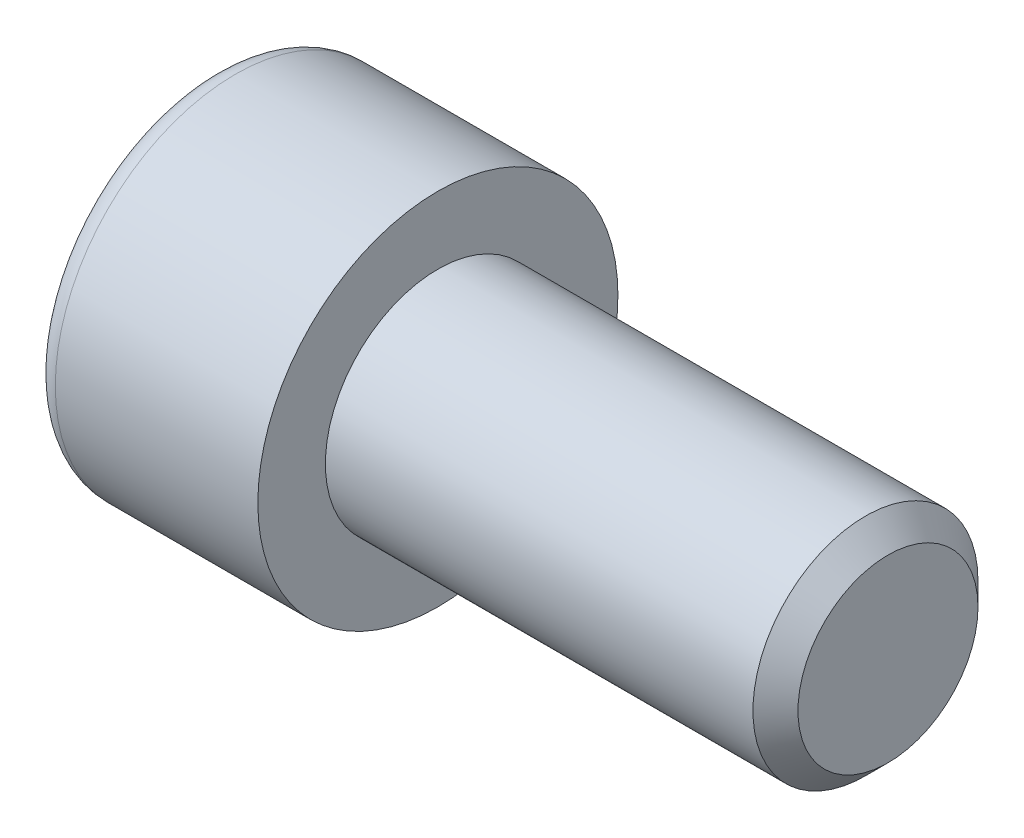
from build123d import *

# Parameters (mm, degrees)
SKETCH_1_R          = 4
EXTRUDE_1_DEPTH     = 5
SKETCH_2_R          = 2.5
EXTRUDE_2_DEPTH     = 10
CHAMFER_1_SIZE      = 0.5
CUT_EXTRUDE_1_DEPTH = 4
FILLET_1_R          = 1
FILLET_2_R          = 0.5


with BuildPart() as part:
    # Эскиз1 → Вытянуть1 (new body)
    with BuildSketch(Plane(origin=(0, 0, 0), x_dir=(0, 0, -1), z_dir=(1, 0, 0))):
        Circle(SKETCH_1_R)
    extrude(amount=EXTRUDE_1_DEPTH)

    # Эскиз2 → Вытянуть2 (add)
    with BuildSketch(Plane(origin=(5, 0, 0), x_dir=(0, 0, -1), z_dir=(1, 0, 0))):
        Circle(SKETCH_2_R)
    extrude(amount=EXTRUDE_2_DEPTH)

    # Фаска1
    chamfer_1_edges = [part.edges().sort_by_distance(p)[0] for p in [
        (15, 0, 2.5),
    ]]
    chamfer(chamfer_1_edges, length=CHAMFER_1_SIZE)

    # Эскиз3 → Вырез-Вытянуть1 (cut)
    with BuildSketch(Plane.ZY):
        Polygon((0, 2.309401077), (-2, 1.154700538), (-2, -1.154700538), (0, -2.309401077), (2, -1.154700538), (2, 1.154700538), align=None)
    extrude(amount=-CUT_EXTRUDE_1_DEPTH, mode=Mode.SUBTRACT)

    # Скругление1
    fillet_1_edges = [part.edges().sort_by_distance(p)[0] for p in [
        (4, 1.732050808, 1),
        (4, 0, 2),
        (4, -1.732050808, 1),
        (4, -1.732050808, -1),
        (4, 0, -2),
        (4, 1.732050808, -1),
    ]]
    fillet(fillet_1_edges, radius=FILLET_1_R)

    # Скругление2
    fillet_2_edges = [part.edges().sort_by_distance(p)[0] for p in [
        (0, 0, 4),
    ]]
    fillet(fillet_2_edges, radius=FILLET_2_R)


solid = part.part
